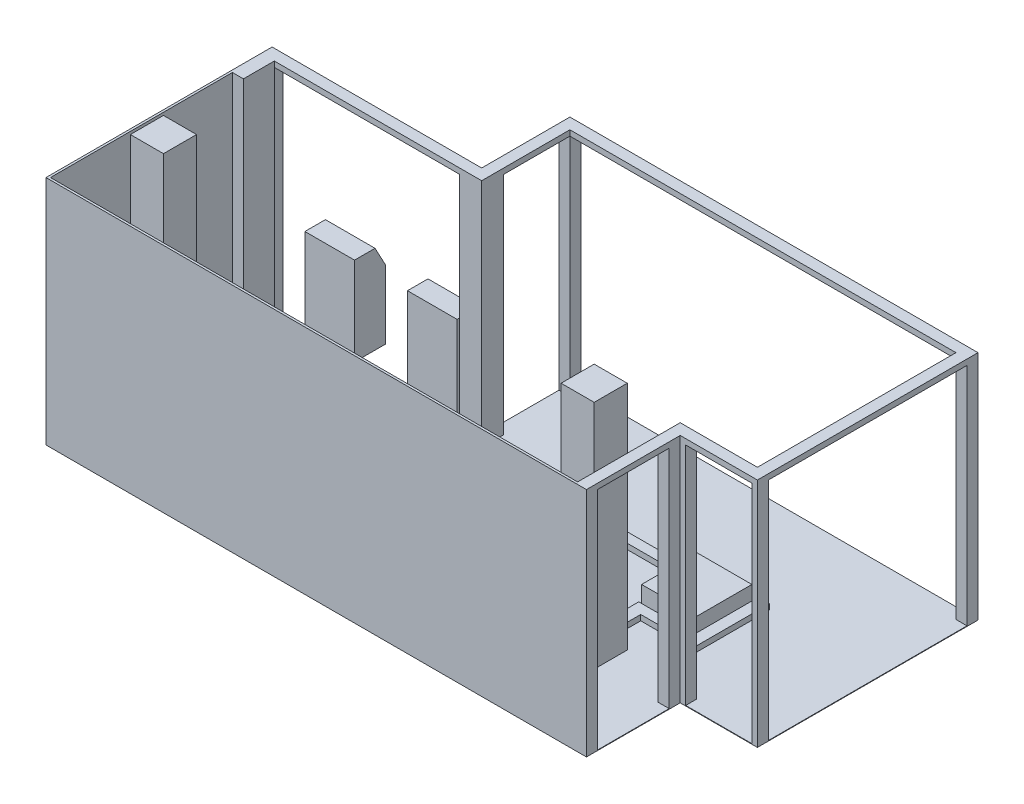
from build123d import *

# Parameters (mm, degrees)
SALIENTE_EXTRUIR1_DEPTH   = 2100
CROQUIS1_W                = 300
CROQUIS1_H                = 300
SALIENTE_EXTRUIR1_2_DEPTH = 2100
CROQUIS3_W                = 300
CROQUIS3_H                = 300
SALIENTE_EXTRUIR2_DEPTH   = 2100
CROQUIS3_W_2              = 100
CROQUIS3_H_2              = 280
SALIENTE_EXTRUIR2_2_DEPTH = 2100
CROQUIS4_W                = 180
CROQUIS4_H                = 180
SALIENTE_EXTRUIR3_DEPTH   = 200
CROQUIS6_W                = 1800
CROQUIS6_H                = 2050
CORTAR_EXTRUIR1_DEPTH     = 100
CROQUIS7_W                = 600
CROQUIS7_H                = 2050
CORTAR_EXTRUIR2_DEPTH     = 100
CROQUIS8_W                = 3500
CROQUIS8_H                = 2050
CORTAR_EXTRUIR3_DEPTH     = 100
CROQUIS9_W                = 650
CROQUIS9_H                = 2050
CORTAR_EXTRUIR4_DEPTH     = 100
CROQUIS10_W               = 600
CROQUIS10_H               = 2050
CORTAR_EXTRUIR5_DEPTH     = 100
CROQUIS11_W               = 1700
CROQUIS11_H               = 2050
CORTAR_EXTRUIR6_DEPTH     = 100
SALIENTE_EXTRUIR5_DEPTH   = 5
CROQUIS13_W               = 500
CROQUIS13_H               = 500
SALIENTE_EXTRUIR6_DEPTH   = 150
CROQUIS14_W               = 500
CROQUIS14_H               = 500
SALIENTE_EXTRUIR7_DEPTH   = 200
CROQUIS15_W               = 450
CROQUIS15_H               = 280
SALIENTE_EXTRUIR8_DEPTH   = 800
CORTAR_EXTRUIR7_REACH     = 5886.852
SALIENTE_EXTRUIR11_DEPTH  = 50
SALIENTE_EXTRUIR12_DEPTH  = 50
SALIENTE_EXTRUIR13_DEPTH  = 50
CROQUIS22_W               = 250
CROQUIS22_H               = 200
SALIENTE_EXTRUIR14_DEPTH  = 150
CROQUIS23_W               = 300
CROQUIS23_H               = 300
SALIENTE_EXTRUIR15_DEPTH  = 50


with BuildPart() as part:
    # Croquis1 → Saliente-Extruir1 (new body)
    with BuildSketch(Plane(origin=(0, 0, 0), x_dir=(1, 0, 0), z_dir=(0, 1, 0))):
        Polygon((1253.581591405, -550.359833019), (1253.581591405, -1400.359833019), (-3646.418408595, -1400.359833019), (-3646.418408595, -250.359833019), (-3646.418408595, 649.640166981), (-1746.418408595, 649.640166981), (-1746.418408595, 1449.640166981), (1953.581591405, 1449.640166981), (1953.581591405, -550.359833019), align=None)
        Polygon((-1646.418408595, 549.640166981), (-3626.418408595, 549.640166981), (-3626.418408595, -1380.359833019), (1153.581591405, -1380.359833019), (1153.581591405, -450.359833019), (1853.581591405, -450.359833019), (1853.581591405, 1349.640166981), (-1646.418408595, 1349.640166981), align=None, mode=Mode.SUBTRACT)
    extrude(amount=SALIENTE_EXTRUIR1_DEPTH)

    # Croquis6 → Cortar-Extruir1 (cut)
    with BuildSketch(Plane(origin=(1953.581591405, 0, 0), x_dir=(0, 0, -1), z_dir=(1, 0, 0))):
        with Locations((449.640166981, 1025)):
            Rectangle(CROQUIS6_W, CROQUIS6_H)
    extrude(amount=-CORTAR_EXTRUIR1_DEPTH, mode=Mode.SUBTRACT)

    # Croquis7 → Cortar-Extruir2 (cut)
    with BuildSketch(Plane.XY.offset(550.359833019)):
        with Locations((1603.581591405, 1025)):
            Rectangle(CROQUIS7_W, CROQUIS7_H)
    extrude(amount=-CORTAR_EXTRUIR2_DEPTH, mode=Mode.SUBTRACT)

    # Croquis8 → Cortar-Extruir3 (cut)
    with BuildSketch(Plane(origin=(0, 0, -1449.640166981), x_dir=(-1, 0, 0), z_dir=(0, 0, -1))):
        with Locations((-103.581591405, 1025)):
            Rectangle(CROQUIS8_W, CROQUIS8_H)
    extrude(amount=-CORTAR_EXTRUIR3_DEPTH, mode=Mode.SUBTRACT)

    # Croquis9 → Cortar-Extruir4 (cut)
    with BuildSketch(Plane(origin=(1253.581591405, 0, 0), x_dir=(0, 0, -1), z_dir=(1, 0, 0))):
        with Locations((-975.359833019, 1025)):
            Rectangle(CROQUIS9_W, CROQUIS9_H)
    extrude(amount=-CORTAR_EXTRUIR4_DEPTH, mode=Mode.SUBTRACT)

    # Croquis10 → Cortar-Extruir5 (cut)
    with BuildSketch(Plane.ZY.offset(1746.418408595)):
        with Locations((-1049.640166981, 1025)):
            Rectangle(CROQUIS10_W, CROQUIS10_H)
    extrude(amount=-CORTAR_EXTRUIR5_DEPTH, mode=Mode.SUBTRACT)

    # Croquis11 → Cortar-Extruir6 (cut)
    with BuildSketch(Plane(origin=(0, 0, -649.640166981), x_dir=(-1, 0, 0), z_dir=(0, 0, -1))):
        with Locations((2696.418408595, 1025)):
            Rectangle(CROQUIS11_W, CROQUIS11_H)
    extrude(amount=-CORTAR_EXTRUIR6_DEPTH, mode=Mode.SUBTRACT)



with BuildPart() as body_2:
    # Croquis1 → Saliente-Extruir1 2 (new body)
    with BuildSketch(Plane(origin=(0, 0, 0), x_dir=(1, 0, 0), z_dir=(0, 1, 0))):
        with Locations((453.581591405, -530.359833019)):
            Rectangle(CROQUIS1_W, CROQUIS1_H)
    extrude(amount=SALIENTE_EXTRUIR1_2_DEPTH)


with BuildPart() as body_3:
    # Croquis3 → Saliente-Extruir2 (new body)
    with BuildSketch(Plane(origin=(0, 0, 0), x_dir=(1, 0, 0), z_dir=(0, 1, 0))):
        with Locations((-3451.418408595, -530.359833019)):
            Rectangle(CROQUIS3_W, CROQUIS3_H)
    extrude(amount=SALIENTE_EXTRUIR2_DEPTH)


with BuildPart() as body_4:
    # Croquis3 → Saliente-Extruir2 2 (new body)
    with BuildSketch(Plane(origin=(0, 0, 0), x_dir=(1, 0, 0), z_dir=(0, 1, 0))):
        with Locations((-3576.418408595, 409.640166981)):
            Rectangle(CROQUIS3_W_2, CROQUIS3_H_2)
    extrude(amount=SALIENTE_EXTRUIR2_2_DEPTH)


with BuildPart() as body_5:
    # Croquis4 → Saliente-Extruir3 (new body)
    with BuildSketch(Plane(origin=(0, 0, 0), x_dir=(1, 0, 0), z_dir=(0, 1, 0))):
        with Locations((-3506.418408595, 83.843678965)):
            Rectangle(CROQUIS4_W, CROQUIS4_H)
    extrude(amount=SALIENTE_EXTRUIR3_DEPTH)


with BuildPart() as part_1:
    add(part.part)

    add(body_2.part)  # Saliente-Extruir5 merges body 2

    add(body_3.part)  # Saliente-Extruir5 merges body 3

    add(body_4.part)  # Saliente-Extruir5 merges body 4

    add(body_5.part)  # Saliente-Extruir5 merges body 5
    # Croquis12 → Saliente-Extruir5 (add)
    with BuildSketch(Plane(origin=(0, 0, 0), x_dir=(1, 0, 0), z_dir=(0, 1, 0))):
        Polygon((-3646.418408595, 649.640166981), (-3646.418408595, -1400.359833019), (1253.581591405, -1400.359833019), (1253.581591405, -550.359833019), (1953.581591405, -550.359833019), (1953.581591405, 1449.640166981), (-1746.418408595, 1449.640166981), (-1746.418408595, 649.640166981), align=None)
    extrude(amount=SALIENTE_EXTRUIR5_DEPTH)

    # Croquis13 → Saliente-Extruir6 (add)
    with BuildSketch(Plane(origin=(0, 5, 0), x_dir=(1, 0, 0), z_dir=(0, 1, 0))):
        with Locations((553.581591405, 299.640166981)):
            Rectangle(CROQUIS13_W, CROQUIS13_H)
    extrude(amount=SALIENTE_EXTRUIR6_DEPTH)

    # Croquis14 → Saliente-Extruir7 (add)
    with BuildSketch(Plane(origin=(0, 5, 0), x_dir=(1, 0, 0), z_dir=(0, 1, 0))):
        with Locations((-2235.739490602, -380.359833019)):
            Rectangle(CROQUIS14_W, CROQUIS14_H)
    extrude(amount=SALIENTE_EXTRUIR7_DEPTH)

    # Croquis15 → Saliente-Extruir8 (add)
    with BuildSketch(Plane(origin=(0, 0, 0), x_dir=(1, 0, 0), z_dir=(0, 1, 0))):
        with Locations((-3124.250184005, 789.640166981)):
            Rectangle(CROQUIS15_W, CROQUIS15_H)
        with Locations((-2194.250184005, 789.640166981)):
            Rectangle(CROQUIS15_W, CROQUIS15_H)
    extrude(amount=SALIENTE_EXTRUIR8_DEPTH)

    # Cortar-Extruir7: up to this face of the body (flat: up to its plane)
    cortar_extruir7_end = Plane(part_1.part.faces().sort_by_distance((-1969.250184005, 400, -789.640166981))[0])
    # Croquis16 → Cortar-Extruir7 (cut, up to the picked face)
    with BuildSketch(Plane.ZY.offset(3349.250184005), mode=Mode.PRIVATE) as cortar_extruir7_sk1:
        Polygon((-929.640166981, 623.785690967), (-835.666652808, 800), (-929.640166981, 800), align=None)
    cortar_extruir7_tool1 = split(extrude(cortar_extruir7_sk1.sketch, amount=-CORTAR_EXTRUIR7_REACH, mode=Mode.PRIVATE), bisect_by=cortar_extruir7_end, keep=Keep.BOTH, mode=Mode.PRIVATE)
    add(cortar_extruir7_tool1.solids().sort_by(Axis((-3349.250184, 741.261897, -898.315662), (1, 0, 0)))[0], mode=Mode.SUBTRACT)

    # Croquis19 → Saliente-Extruir11 (add)
    with BuildSketch(Plane(origin=(0, 5, 0), x_dir=(1, 0, 0), z_dir=(0, 1, 0))):
        Polygon((327.416440249, -380.359833019), (327.416440249, 0), (833.379737165, 0), (833.379737165, 577.826704942), (934.572396548, 577.826704942), (934.572396548, -90.044846986), (435.355276925, -90.044846986), (435.355276925, -380.359833019), align=None)
    extrude(amount=SALIENTE_EXTRUIR11_DEPTH)

    # Croquis20 → Saliente-Extruir12 (add)
    with BuildSketch(Plane(origin=(0, 5, 0), x_dir=(1, 0, 0), z_dir=(0, 1, 0))):
        Polygon((-2236.13093079, 549.640166981), (-2236.13093079, 407.970443845), (145.26965336, 407.970443845), (145.26965336, 497.970443845), (-2134.938271407, 497.970443845), (-2134.938271407, 549.640166981), align=None)
    extrude(amount=SALIENTE_EXTRUIR12_DEPTH)

    # Croquis21 → Saliente-Extruir13 (add)
    with BuildSketch(Plane(origin=(0, 5, 0), x_dir=(1, 0, 0), z_dir=(0, 1, 0))):
        Polygon((327.416440249, -306.227432097), (-1959.53766181, -306.227432097), (-1959.53766181, -100), (-3160.357219823, -100), (-3160.357219823, 549.640166981), (-3060.357219823, 549.640166981), (-3060.357219823, 0), (-1865.091179719, 0), (-1865.091179719, -206.227432097), (327.416440249, -206.227432097), align=None)
    extrude(amount=SALIENTE_EXTRUIR13_DEPTH)

    # Croquis22 → Saliente-Extruir14 (add)
    with BuildSketch(Plane(origin=(0, 5, 0), x_dir=(1, 0, 0), z_dir=(0, 1, 0))):
        with Locations((557.221387347, -930.359833019)):
            Rectangle(CROQUIS22_W, CROQUIS22_H)
    extrude(amount=SALIENTE_EXTRUIR14_DEPTH)

    # Croquis23 → Saliente-Extruir15 (add)
    with BuildSketch(Plane(origin=(0, 5, 0), x_dir=(1, 0, 0), z_dir=(0, 1, 0))):
        with Locations((275.462852563, -1063.078476636)):
            Rectangle(CROQUIS23_W, CROQUIS23_H)
    extrude(amount=SALIENTE_EXTRUIR15_DEPTH)


solid = part_1.part
